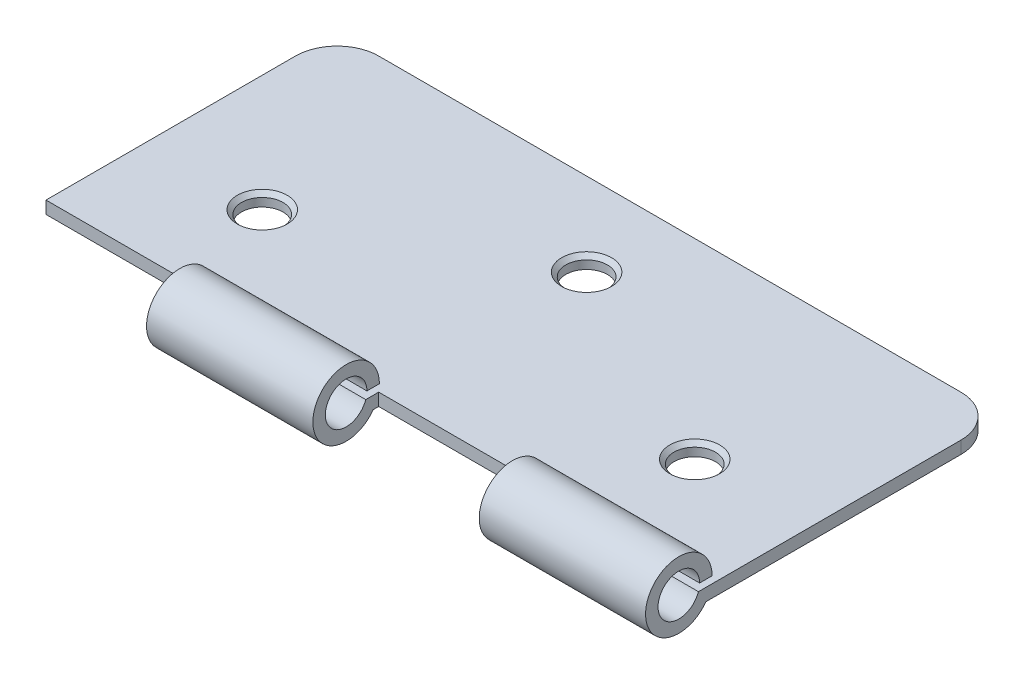
from build123d import *

# Parameters (mm, degrees)
BOSS_EXTRUDE1_DEPTH = 1.5
BOSS_EXTRUDE3_DEPTH = 20
LPATTERN1_COUNT     = 2
LPATTERN1_PITCH     = 40
SKETCH3_R           = 2.5
CUT_EXTRUDE1_DEPTH  = 20
CHAMFER1_SIZE       = 0.5


with BuildPart() as part:
    # Sketch1 → Boss-Extrude1 (new body)
    with BuildSketch(Plane(origin=(0, 0, 0), x_dir=(1, 0, 0), z_dir=(0, 1, 0))):
        with BuildLine():
            Line((-35, 17.5), (35, 17.5))
            ThreePointArc((35, 17.5), (38.535533906, 16.035533906), (40, 12.5))
            Line((40, 12.5), (40, -17.5))
            Line((40, -17.5), (-40, -17.5))
            Line((-40, -17.5), (-40, 12.5))
            ThreePointArc((-40, 12.5), (-38.535533906, 16.035533906), (-35, 17.5))
        make_face()
    extrude(amount=BOSS_EXTRUDE1_DEPTH)

    # Sketch2 → Boss-Extrude3 (add)
    with BuildSketch(Plane(origin=(40, 0, 0), x_dir=(0, 0, -1), z_dir=(1, 0, 0))):
        with BuildLine():
            Line((-17.5, 0), (-18.161538273, 0))
            ThreePointArc((-18.161538273, 0), (-25.221236665, 3.55341606), (-17.412973279, 2.329843428))
            Line((-17.412973279, 2.329843428), (-18.912973279, 2.329843428))
            ThreePointArc((-18.912973279, 2.329843428), (-23.877281896, 2.750774588), (-19.054719713, 1.5))
            Line((-19.054719713, 1.5), (-17.5, 1.5))
            Line((-17.5, 1.5), (-17.5, 0))
        make_face()
    boss_extrude3 = extrude(amount=-BOSS_EXTRUDE3_DEPTH)

    # LPattern1: Boss-Extrude3 ×2
    with Locations(*[(-i * LPATTERN1_PITCH, 0, 0) for i in range(1, LPATTERN1_COUNT)]):
        add(boss_extrude3)

    # Sketch3 → Cut-Extrude1 (cut)
    with BuildSketch(Plane(origin=(0, 1.5, 0), x_dir=(1, 0, 0), z_dir=(0, 1, 0))):
        with Locations(Location((0, 7.5, 0), (0, 0, 270))):
            Circle(SKETCH3_R)
        with Locations(Location((-26, -5.5, 0), (0, 0, 270))):
            Circle(SKETCH3_R)
        with Locations(Location((26, -5.5, 0), (0, 0, 270))):
            Circle(SKETCH3_R)
    extrude(amount=-CUT_EXTRUDE1_DEPTH, mode=Mode.SUBTRACT)

    # Chamfer1
    chamfer1_edges = [part.edges().sort_by_distance(p)[0] for p in [
        (0, 1.5, -10),
        (-26, 1.5, 3),
        (26, 1.5, 3),
    ]]
    chamfer(chamfer1_edges, length=CHAMFER1_SIZE)


solid = part.part
